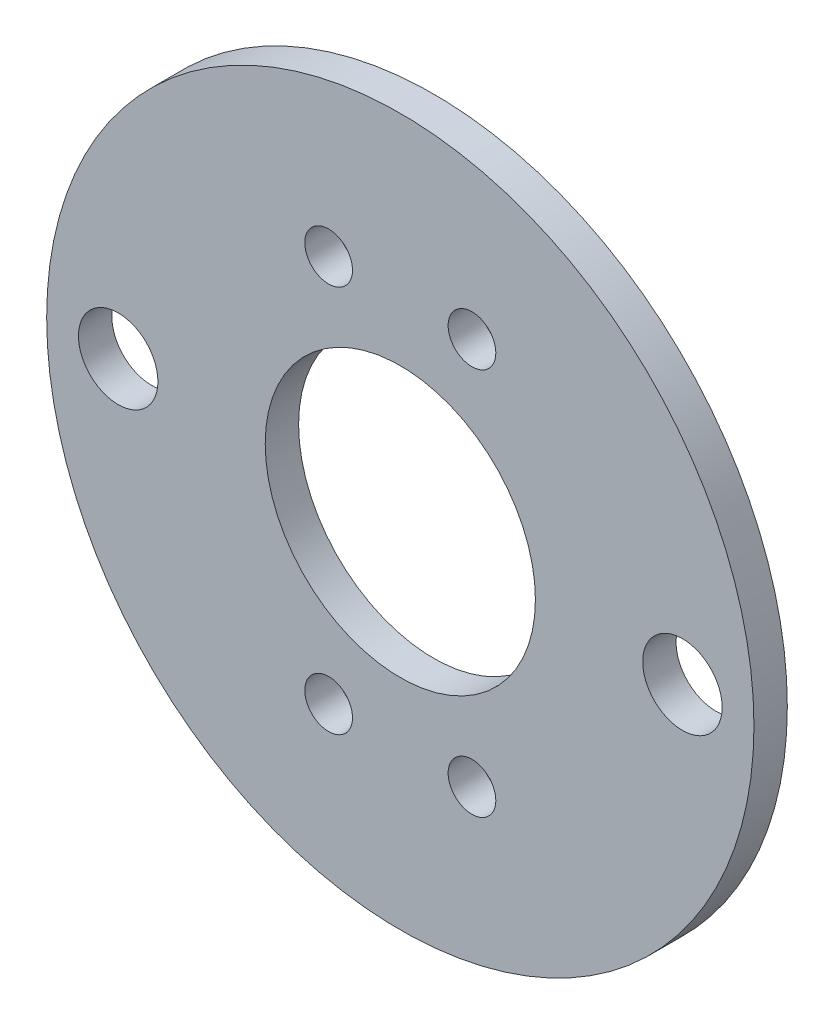
from build123d import *

# Parameters (mm, degrees)
SKETCH1_R               = 22.25
SKETCH1_R_2             = 8.5
SKETCH1_R_3             = 2.5
BOSS_EXTRUDE1_DEPTH     = 2.1
CUT_EXTRUDE2_DEPTH      = 32.536248984
CUT_EXTRUDE2_DEPTH_BACK = 32.536248984
SKETCH3_R               = 1.5


with BuildPart() as part:
    # Sketch1 → Boss-Extrude1 (new body)
    with BuildSketch(Plane.XY):
        Circle(SKETCH1_R)
        Circle(SKETCH1_R_2, mode=Mode.SUBTRACT)
        with Locations((17.75, 0)):
            Circle(SKETCH1_R_3, mode=Mode.SUBTRACT)
        with Locations((-17.75, 0)):
            Circle(SKETCH1_R_3, mode=Mode.SUBTRACT)
    extrude(amount=BOSS_EXTRUDE1_DEPTH)

    # Sketch3 → Cut-Extrude2 (cut, two sides: drawn at the far end of the back side and taken through both)
    with BuildSketch(Plane.XY.offset(-CUT_EXTRUDE2_DEPTH_BACK)):
        with Locations((4.508802817, -12.193059385)):
            Circle(SKETCH3_R)
        with Locations((4.508802817, 12.193059385)):
            Circle(SKETCH3_R)
        with Locations((-4.508802817, -12.193059385)):
            Circle(SKETCH3_R)
        with Locations((-4.508802817, 12.193059385)):
            Circle(SKETCH3_R)
    extrude(amount=CUT_EXTRUDE2_DEPTH + CUT_EXTRUDE2_DEPTH_BACK, mode=Mode.SUBTRACT)


solid = part.part
